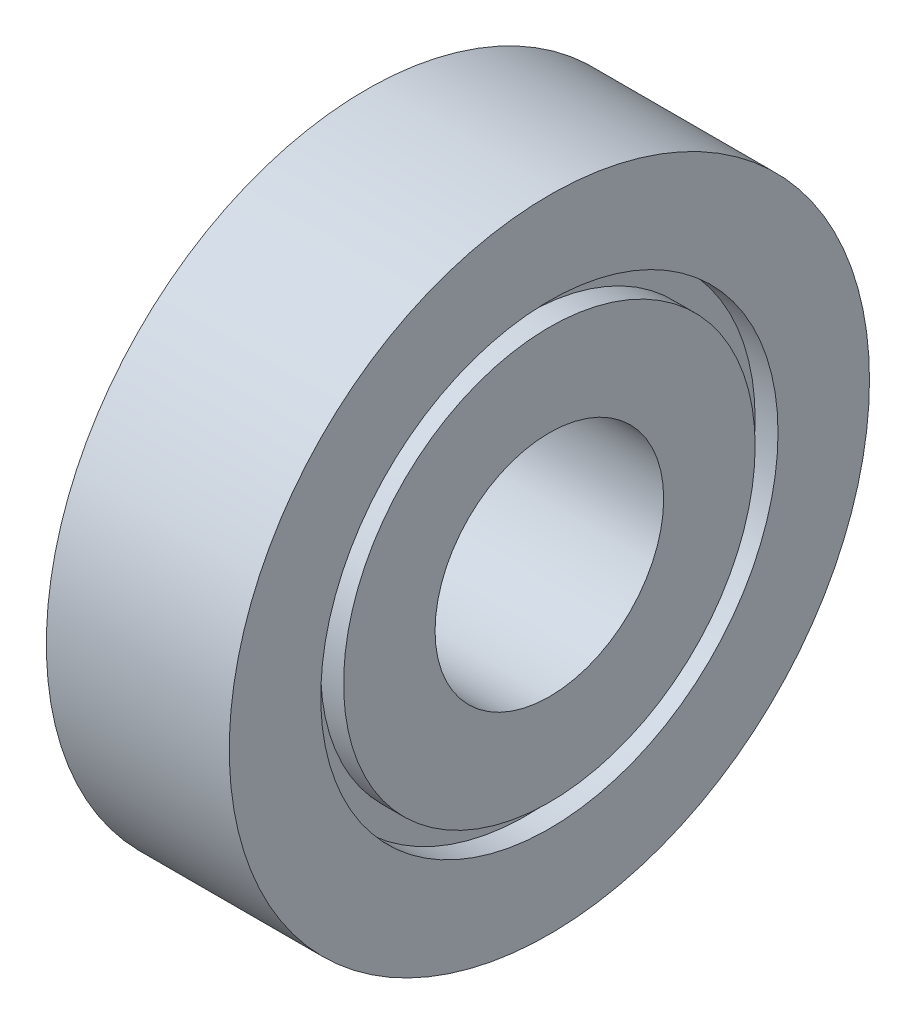
from build123d import *

# Parameters (mm, degrees)
SKETCH2_R           = 7
SKETCH2_R_2         = 5
BOSS_EXTRUDE1_DEPTH = 2
SKETCH2_3_R         = 5
SKETCH2_3_R_2       = 4.5
BOSS_EXTRUDE2_DEPTH = 1.5
SKETCH2_4_R         = 4.5
SKETCH2_4_R_2       = 2.5
BOSS_EXTRUDE3_DEPTH = 2


with BuildPart() as part:
    # Sketch2 → Boss-Extrude1 (new, symmetric)
    with BuildSketch(Plane(origin=(0, 0, 0), x_dir=(0, 0, -1), z_dir=(1, 0, 0))):
        Circle(SKETCH2_R)
        Circle(SKETCH2_R_2, mode=Mode.SUBTRACT)
    extrude(amount=BOSS_EXTRUDE1_DEPTH, both=True)

    # Sketch2<3> → Boss-Extrude2 (add, symmetric)
    with BuildSketch(Plane(origin=(0, 0, 0), x_dir=(0, 0, -1), z_dir=(1, 0, 0))):
        Circle(SKETCH2_3_R)
        Circle(SKETCH2_3_R_2, mode=Mode.SUBTRACT)
    extrude(amount=BOSS_EXTRUDE2_DEPTH, both=True)

    # Sketch2<4> → Boss-Extrude3 (add, symmetric)
    with BuildSketch(Plane(origin=(0, 0, 0), x_dir=(0, 0, -1), z_dir=(1, 0, 0))):
        Circle(SKETCH2_4_R)
        Circle(SKETCH2_4_R_2, mode=Mode.SUBTRACT)
    extrude(amount=BOSS_EXTRUDE3_DEPTH, both=True)


solid = part.part
